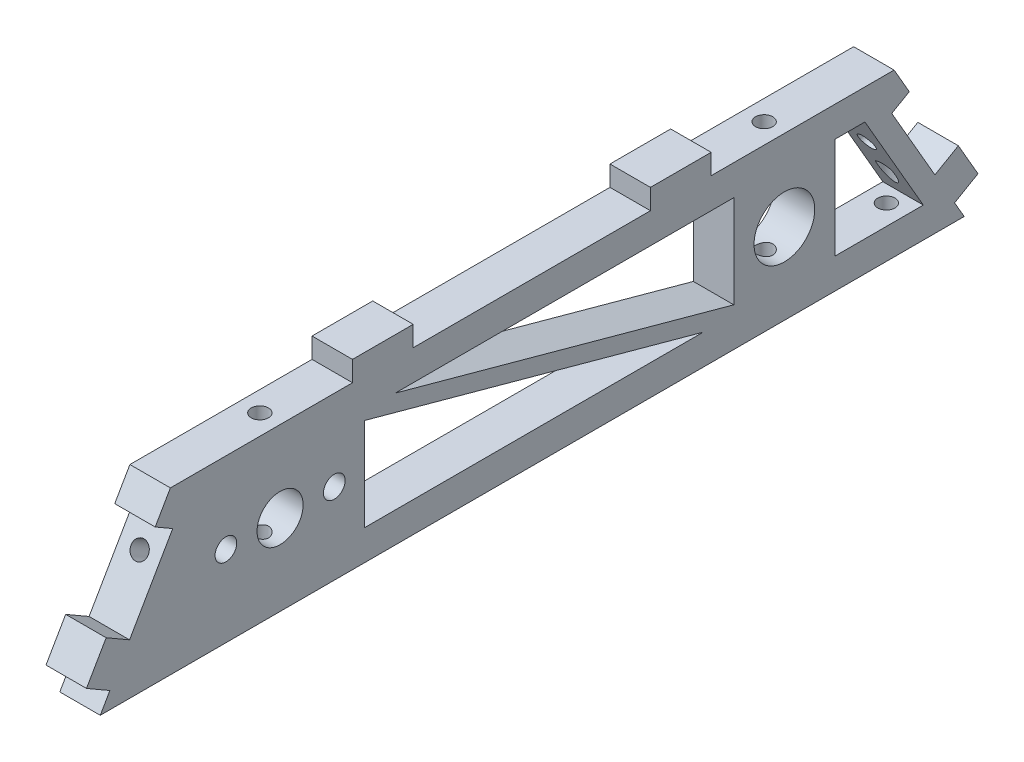
from build123d import *

# Parameters (mm, degrees)
SKETCH1_R                     = 3.6195
SKETCH1_R_2                   = 4.7625
SKETCH1_R_3                   = 1.6999966
BOSS_EXTRUDE1_DEPTH           = 6.35
SKETCH12_W                    = 6.35
SKETCH12_H                    = 6.1722
BOSS_EXTRUDE3_DEPTH           = 1.0668
CUT_EXTRUDE1_DEPTH            = 146.254081268
TAP_DRILL_FOR_6_32_TAP4_D     = 2.7051
TAP_DRILL_FOR_6_32_TAP3_D     = 2.7051
TAP_DRILL_FOR_6_32_TAP3_DEPTH = 10.16
TAP_DRILL_FOR_6_32_TAP3_TIP   = 0.81269403
SKETCH20_W                    = 6.35
SKETCH20_H                    = 13.543293675
SKETCH20_H_2                  = 12.7
CUT_EXTRUDE2_DEPTH            = 3.175
SKETCH21_W                    = 6.35
SKETCH21_H                    = 9.525
BOSS_EXTRUDE4_DEPTH           = 3.175


with BuildPart() as part:
    # Sketch1 → Boss-Extrude1 (new body)
    with BuildSketch(Plane(origin=(0, 0, 0), x_dir=(0, 0, -1), z_dir=(1, 0, 0))):
        Polygon((0, 0), (-14.664696837, 25.4), (-128.210303163, 25.4), (-142.875, 0), align=None)
        with Locations((-110.998, 12.7)):
            Circle(SKETCH1_R, mode=Mode.SUBTRACT)
        with Locations((-31.877, 12.7)):
            Circle(SKETCH1_R_2, mode=Mode.SUBTRACT)
        with Locations((-102.4979916, 12.7)):
            Circle(SKETCH1_R_3, mode=Mode.SUBTRACT)
        with Locations((-119.4980084, 12.7)):
            Circle(SKETCH1_R_3, mode=Mode.SUBTRACT)
    extrude(amount=BOSS_EXTRUDE1_DEPTH)

    # Sketch12 → Boss-Extrude3 (add)
    with BuildSketch(Plane(origin=(0, 0, 0), x_dir=(-1, 0, 0), z_dir=(0, 0.49999999999999806, -0.8660254037844398))):
        with Locations((-3.175, 7.9375)):
            Rectangle(SKETCH12_W, SKETCH12_H)
    boss_extrude3 = extrude(amount=BOSS_EXTRUDE3_DEPTH)

    # Sketch19 → Cut-Extrude1 (cut, through all)
    with BuildSketch(Plane.ZY):
        Polygon((92.930922513, 20.6375), (39.8145, 20.6375), (39.8145, 6.079337508), align=None)
        Polygon((97.7354916, 4.7625), (97.7354916, 19.320662492), (44.619069087, 4.7625), align=None)
        Polygon((23.9395, 20.6375), (23.9395, 4.7625), (10.081979076, 4.7625), (19.247414599, 20.6375), align=None)
    extrude(amount=-CUT_EXTRUDE1_DEPTH, mode=Mode.SUBTRACT)

    # Tap Drill for #6-32 Tap4 (through all)
    with Locations(Plane(origin=(0, 25.4, 0), x_dir=(1, 0, 0), z_dir=(0, 1, 0))):
        with Locations((3.175, -110.998), (3.175, -31.877)):
            Hole(TAP_DRILL_FOR_6_32_TAP4_D / 2)

    # Tap Drill for #6-32 Tap3
    with Locations(Plane(origin=(0, 0, 0), x_dir=(-1, 0, 0), z_dir=(0, -1, 0))):
        with Locations((-3.175, -130.175), (-3.175, -12.7)):
            Hole(TAP_DRILL_FOR_6_32_TAP3_D / 2, depth=TAP_DRILL_FOR_6_32_TAP3_DEPTH)
            with Locations((0, 0, -(TAP_DRILL_FOR_6_32_TAP3_DEPTH + TAP_DRILL_FOR_6_32_TAP3_TIP / 2))):  # 118° drill point
                Cone(0, TAP_DRILL_FOR_6_32_TAP3_D / 2, TAP_DRILL_FOR_6_32_TAP3_TIP, mode=Mode.SUBTRACT)

    # Sketch15 → Tap Drill for #6-32 Tap2 (revolve, cut)
    with BuildSketch(Plane(origin=(3.175, 17.795609612, 10.2743), x_dir=(0, 0.8660254037844398, 0.49999999999999806), z_dir=(1, 0, 0))):
        Polygon((0, 0), (0, 8.43269403), (1.35255, 7.62), (1.35255, 0), align=None)
    tap_drill_for_6_32_tap2 = revolve(axis=Axis((3.175, 20.970609612, 4.775038686), (0, -0.499999999999998, 0.8660254037844398)), mode=Mode.SUBTRACT)

    # Sketch20 → Cut-Extrude2 (cut)
    with BuildSketch(Plane(origin=(0, 0, 0), x_dir=(-1, 0, 0), z_dir=(0, 0.49999999999999806, -0.8660254037844398))):
        with Locations((-3.175, 17.795246838)):
            Rectangle(SKETCH20_W, SKETCH20_H)
        with Locations((-3.175, -1.4986)):
            Rectangle(SKETCH20_W, SKETCH20_H_2)
    cut_extrude2 = extrude(amount=-CUT_EXTRUDE2_DEPTH, mode=Mode.SUBTRACT)

    # Mirror1: Boss-Extrude3, Tap Drill for #6-32 Tap2, Cut-Extrude2 across plane
    add(boss_extrude3.mirror(Plane(origin=(0, 0, 71.4375), x_dir=(1, 0, 0), z_dir=(0, 0, -1))))
    add(tap_drill_for_6_32_tap2.mirror(Plane(origin=(0, 0, 71.4375), x_dir=(1, 0, 0), z_dir=(0, 0, -1))), mode=Mode.SUBTRACT)
    add(cut_extrude2.mirror(Plane(origin=(0, 0, 71.4375), x_dir=(1, 0, 0), z_dir=(0, 0, -1))), mode=Mode.SUBTRACT)

    # Sketch21 → Boss-Extrude4 (add)
    with BuildSketch(Plane(origin=(0, 25.4, 0), x_dir=(1, 0, 0), z_dir=(0, 1, 0))):
        with Locations((3.175, -48.129196837)):
            Rectangle(SKETCH21_W, SKETCH21_H)
        with Locations((3.175, -94.872803163)):
            Rectangle(SKETCH21_W, SKETCH21_H)
    extrude(amount=BOSS_EXTRUDE4_DEPTH)


solid = part.part
